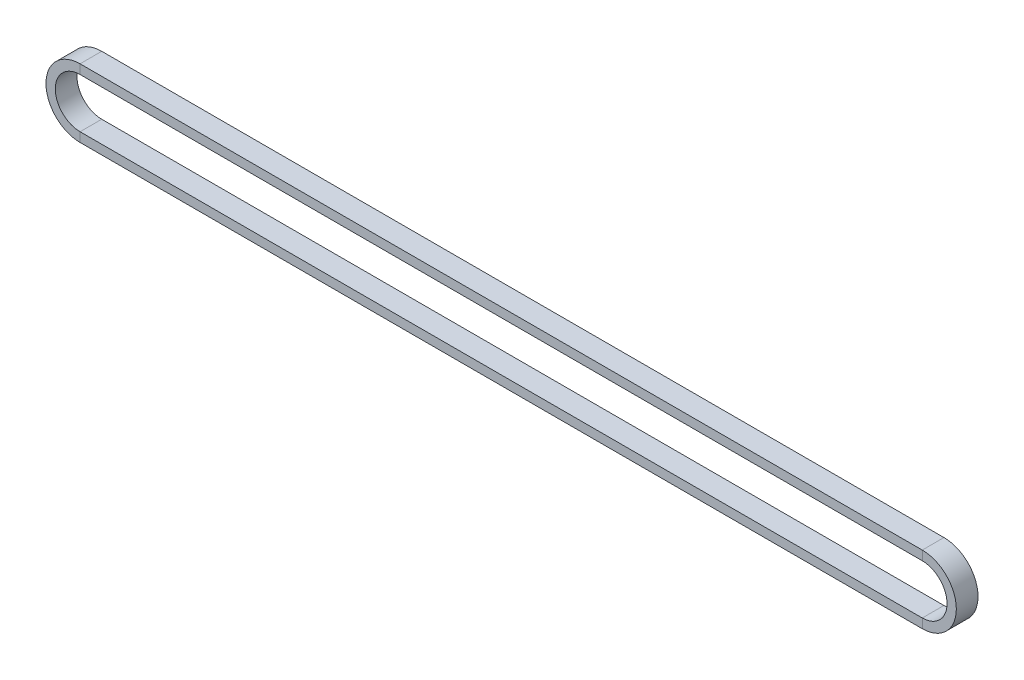
from build123d import *


with BuildPart() as part:
    # Austragung1: sweep along a path in Skizze2
    with BuildLine(Plane.XY) as austragung1_path:
        Line((0, -40), (-1360, -40))
        ThreePointArc((-1360, -40), (-1400, 0), (-1360, 40))
        Line((-1360, 40), (0, 40))
        ThreePointArc((0, 40), (40, 0), (0, -40))
    # 3D-Skizze1 → Austragung1 (sweep)
    with BuildSketch(Plane(origin=(0, 55, -17.5), x_dir=(0, -0.39391929857916763, 0.9191450300180579), z_dir=(-1, 0, 0))):
        Polygon((0, 0), (32.170076051, 13.78717545), (38.078865529, 0), (5.908789479, -13.78717545), align=None)
    sweep(path=austragung1_path.line)


solid = part.part
